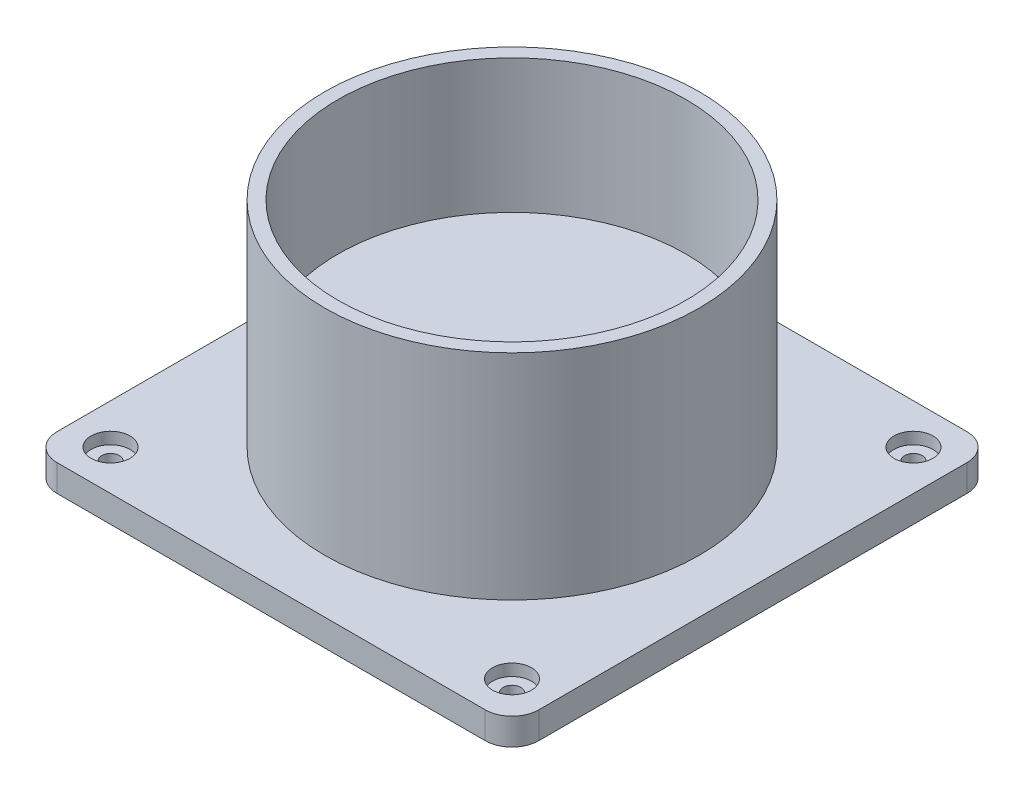
from build123d import *

# Parameters (mm, degrees)
SKETCH4_W                               = 180
SKETCH4_H                               = 180
BOSS_EXTRUDE2_DEPTH                     = 10
SKETCH5_R                               = 70
BOSS_EXTRUDE3_DEPTH                     = 80
SKETCH7_R                               = 65
CUT_EXTRUDE1_DEPTH                      = 50
CBORE_FOR_M6_HEX_HEAD_BOLT2_D           = 6.6
CBORE_FOR_M6_HEX_HEAD_BOLT2_CBORE_D     = 14.55
CBORE_FOR_M6_HEX_HEAD_BOLT2_CBORE_DEPTH = 4.38
FILLET1_R                               = 10


with BuildPart() as part:
    # Sketch4 → Boss-Extrude2 (new body)
    with BuildSketch(Plane(origin=(0, 0, 0), x_dir=(1, 0, 0), z_dir=(0, 1, 0))):
        Rectangle(SKETCH4_W, SKETCH4_H)
    extrude(amount=BOSS_EXTRUDE2_DEPTH)

    # Sketch5 → Boss-Extrude3 (add)
    with BuildSketch(Plane(origin=(0, 10, 0), x_dir=(1, 0, 0), z_dir=(0, 1, 0))):
        with Locations(Location((0, 0, 0), (0, 0, 270))):
            Circle(SKETCH5_R)
    extrude(amount=BOSS_EXTRUDE3_DEPTH)

    # Sketch7 → Cut-Extrude1 (cut)
    with BuildSketch(Plane(origin=(0, 90, 0), x_dir=(1, 0, 0), z_dir=(0, 1, 0))):
        with Locations(Location((0, 0, 0), (0, 0, 270))):
            Circle(SKETCH7_R)
    extrude(amount=-CUT_EXTRUDE1_DEPTH, mode=Mode.SUBTRACT)

    # CBORE for M6 Hex Head Bolt2 (through all)
    with Locations(Plane(origin=(0, 10, 0), x_dir=(1, 0, 0), z_dir=(0, 1, 0))):
        with Locations((-75, 75), (75, 75), (75, -75), (-75, -75)):
            CounterBoreHole(CBORE_FOR_M6_HEX_HEAD_BOLT2_D / 2, CBORE_FOR_M6_HEX_HEAD_BOLT2_CBORE_D / 2, CBORE_FOR_M6_HEX_HEAD_BOLT2_CBORE_DEPTH)

    # Fillet1
    fillet1_edges = [part.edges().sort_by_distance(p)[0] for p in [
        (90, 5, 90),
        (-90, 5, 90),
        (-90, 5, -90),
        (90, 5, -90),
    ]]
    fillet(fillet1_edges, radius=FILLET1_R)


solid = part.part
